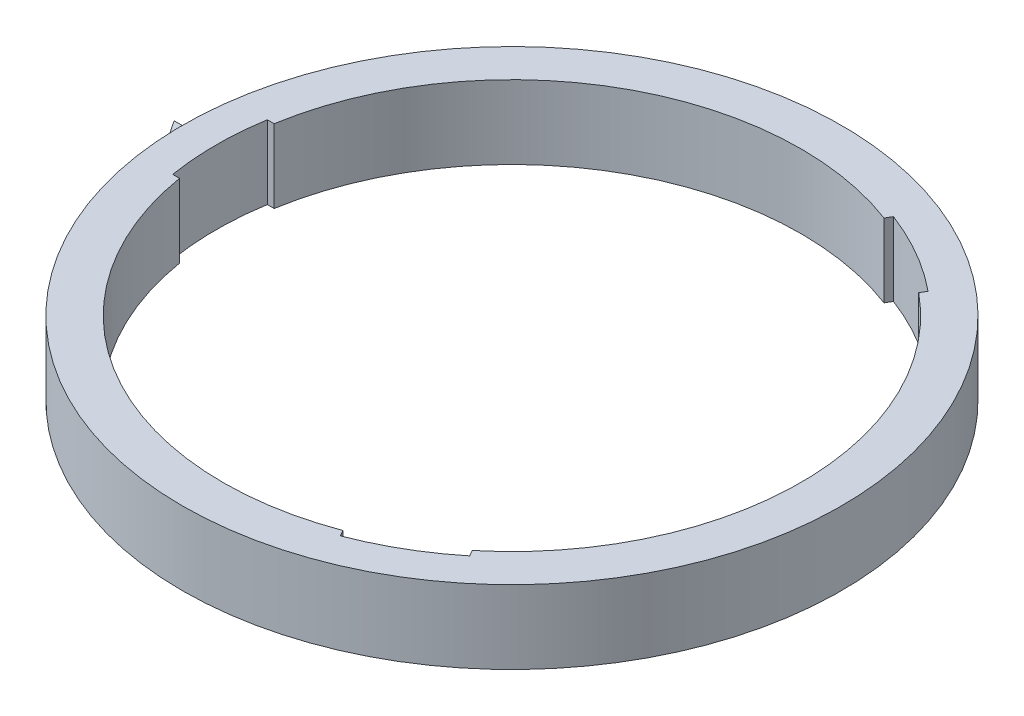
from build123d import *
from OCP.BRepFilletAPI import BRepFilletAPI_MakeChamfer

# Parameters (mm, degrees)
SKETCH1_R           = 19.5
SKETCH1_R_2         = 17.1
BOSS_EXTRUDE1_DEPTH = 4.347826087
BOSS_EXTRUDE2_DEPTH = 1.08695652
CHAMFER1_SIZE       = 0.6
CHAMFER1_SIZE2      = 0.971
CUT_EXTRUDE1_DEPTH  = 29.687564735


with BuildPart() as part:
    # Sketch1 → Boss-Extrude1 (new body)
    with BuildSketch(Plane(origin=(0, 0, 0), x_dir=(1, 0, 0), z_dir=(0, 1, 0))):
        with Locations(Location((0, 0, 0), (0, 0, 270))):
            Circle(SKETCH1_R)
        with Locations(Location((0, 0, 0), (0, 0, 270))):
            Circle(SKETCH1_R_2, mode=Mode.SUBTRACT)
    extrude(amount=BOSS_EXTRUDE1_DEPTH)

    # Sketch2 → Boss-Extrude2 (add, symmetric)
    with BuildSketch(Plane.ZY.offset(19.5)):
        Polygon((0, 0.00928426), (-1.086956522, 2.173913043), (0, 4.338541827), (1.086956522, 2.173913043), align=None)
    extrude(amount=BOSS_EXTRUDE2_DEPTH, both=True)

    # Chamfer1: one chamfer whose edges measure the first distance from different faces: ONE call of the kernel's chamfer builder (chamfer() names one face for all edges)
    chamfer1_edges_1 = [part.edges().sort_by_distance(p)[0] for p in [
        (-20.58695652, 3.256227435, -0.543478261),
    ]]
    chamfer1_side_1 = [part.faces().sort_by_distance(p)[0] for p in [
        (-20.038389639, 3.251243161, -0.545981087),
    ]]
    chamfer1_edges_2 = [part.edges().sort_by_distance(p)[0] for p in [
        (-20.58695652, 1.091598652, -0.543478261),
    ]]
    chamfer1_side_2 = [part.faces().sort_by_distance(p)[0] for p in [
        (-20.038389639, 1.096582926, -0.545981087),
    ]]
    chamfer1_edges_3 = [part.edges().sort_by_distance(p)[0] for p in [
        (-20.58695652, 1.091598652, 0.543478261),
    ]]
    chamfer1_side_3 = [part.faces().sort_by_distance(p)[0] for p in [
        (-20.038389639, 1.096582926, 0.545981087),
    ]]
    chamfer1_edges_4 = [part.edges().sort_by_distance(p)[0] for p in [
        (-20.58695652, 3.256227435, 0.543478261),
    ]]
    chamfer1_side_4 = [part.faces().sort_by_distance(p)[0] for p in [
        (-20.038389639, 3.251243161, 0.545981087),
    ]]
    chamfer1 = BRepFilletAPI_MakeChamfer(part.part.solid().wrapped)
    for e in chamfer1_edges_1:
        chamfer1.Add(CHAMFER1_SIZE, CHAMFER1_SIZE2, e.wrapped, chamfer1_side_1[0].wrapped)  # the first distance lies on this face
    for e in chamfer1_edges_2:
        chamfer1.Add(CHAMFER1_SIZE, CHAMFER1_SIZE2, e.wrapped, chamfer1_side_2[0].wrapped)  # the first distance lies on this face
    for e in chamfer1_edges_3:
        chamfer1.Add(CHAMFER1_SIZE, CHAMFER1_SIZE2, e.wrapped, chamfer1_side_3[0].wrapped)  # the first distance lies on this face
    for e in chamfer1_edges_4:
        chamfer1.Add(CHAMFER1_SIZE, CHAMFER1_SIZE2, e.wrapped, chamfer1_side_4[0].wrapped)  # the first distance lies on this face
    add(Compound.cast(chamfer1.Shape()), mode=Mode.REPLACE)

    # Sketch3 → Cut-Extrude1 (cut, through all)
    with BuildSketch(Plane(origin=(0, 4.347826087, 0), x_dir=(1, 0, 0), z_dir=(0, 1, 0))):
        with BuildLine():
            Line((-17.274547751, 2.8), (-15.753094934, 2.8))
            ThreePointArc((-15.753094934, 2.8), (-16, 0), (-15.753094934, -2.8))
            Line((-15.753094934, -2.8), (-17.274547751, -2.8))
            ThreePointArc((-17.274547751, -2.8), (-17.5, 0), (-17.274547751, 2.8))
        make_face()
        with BuildLine():
            Line((11.062145006, 13.560197191), (10.301418598, 12.242580401))
            ThreePointArc((10.301418598, 12.242580401), (8, 13.856406461), (5.451676336, 15.042580401))
            Line((5.451676336, 15.042580401), (6.212402745, 16.360197191))
            ThreePointArc((6.212402745, 16.360197191), (8.75, 15.155444566), (11.062145006, 13.560197191))
        make_face()
        with BuildLine():
            Line((6.212402745, -16.360197191), (5.451676336, -15.042580401))
            ThreePointArc((5.451676336, -15.042580401), (8, -13.856406461), (10.301418598, -12.242580401))
            Line((10.301418598, -12.242580401), (11.062145006, -13.560197191))
            ThreePointArc((11.062145006, -13.560197191), (8.75, -15.155444566), (6.212402745, -16.360197191))
        make_face()
    extrude(amount=-CUT_EXTRUDE1_DEPTH, mode=Mode.SUBTRACT)


solid = part.part
